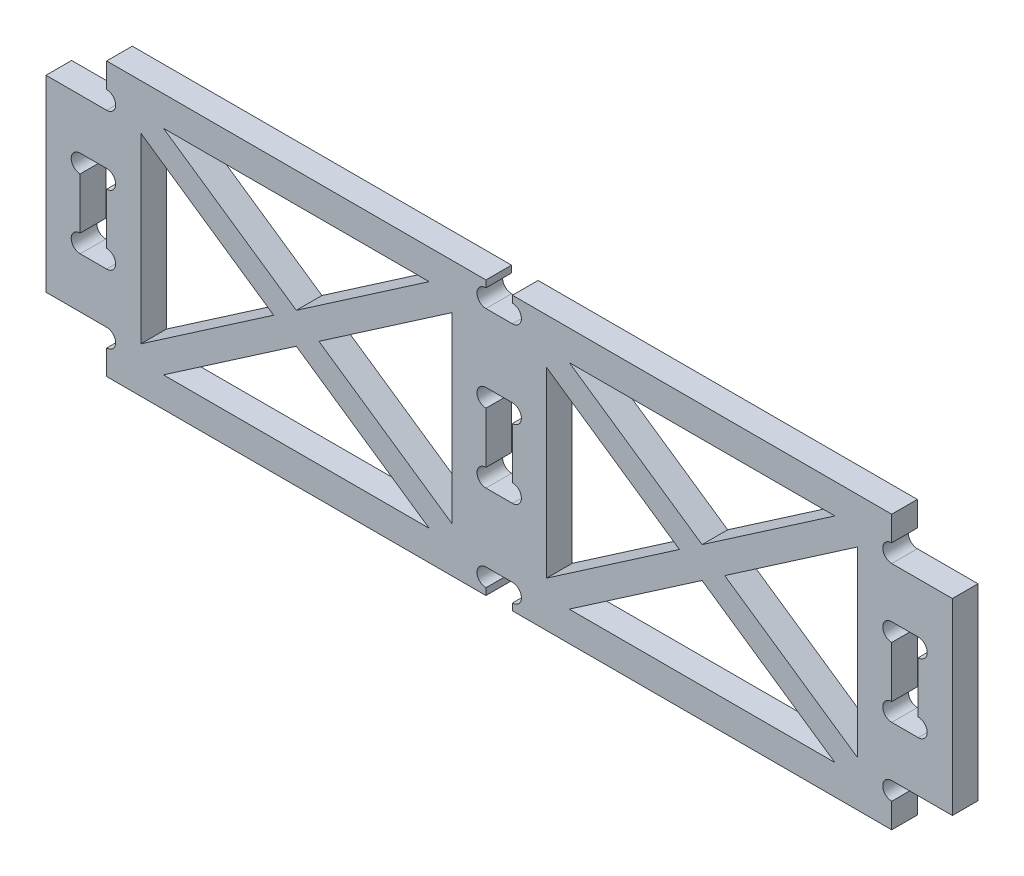
from build123d import *

# Parameters (mm, degrees)
EXTRUDE_1_DEPTH = 3


with BuildPart() as part:
    # 草图1 → 凸台-拉伸1 (new body)
    with BuildSketch(Plane.XY):
        with BuildLine():
            Line((100.55, -11), (100.55, 11))
            Line((100.55, 11), (93.45, 11))
            ThreePointArc((93.45, 11), (92.4, 12.05), (93.45, 13.1))
            Line((93.45, 13.1), (93.45, 16))
            Line((93.45, 16), (49.05, 16))
            Line((49.05, 16), (49.05, 15.2))
            ThreePointArc((49.05, 15.2), (49.79246212, 14.89246212), (50.1, 14.15))
            ThreePointArc((50.1, 14.15), (49.79246212, 13.40753788), (49.05, 13.1))
            Line((49.05, 13.1), (45.95, 13.1))
            ThreePointArc((45.95, 13.1), (44.9, 14.15), (45.95, 15.2))
            Line((45.95, 15.2), (45.95, 16))
            Line((45.95, 16), (1.55, 16))
            Line((1.55, 16), (1.55, 13.1))
            ThreePointArc((1.55, 13.1), (2.29246212, 12.79246212), (2.6, 12.05))
            ThreePointArc((2.6, 12.05), (2.29246212, 11.30753788), (1.55, 11))
            Line((1.55, 11), (-5.55, 11))
            Line((-5.55, 11), (-5.55, -11))
            Line((-5.55, -11), (1.55, -11))
            ThreePointArc((1.55, -11), (2.29246212, -11.30753788), (2.6, -12.05))
            ThreePointArc((2.6, -12.05), (2.29246212, -12.79246212), (1.55, -13.1))
            Line((1.55, -13.1), (1.55, -16))
            Line((1.55, -16), (45.95, -16))
            Line((45.95, -16), (45.95, -15.2))
            ThreePointArc((45.95, -15.2), (44.9, -14.15), (45.95, -13.1))
            Line((45.95, -13.1), (49.05, -13.1))
            ThreePointArc((49.05, -13.1), (49.79246212, -13.40753788), (50.1, -14.15))
            ThreePointArc((50.1, -14.15), (49.79246212, -14.89246212), (49.05, -15.2))
            Line((49.05, -15.2), (49.05, -16))
            Line((49.05, -16), (93.45, -16))
            Line((93.45, -16), (93.45, -13.1))
            ThreePointArc((93.45, -13.1), (92.4, -12.05), (93.45, -11))
            Line((93.45, -11), (100.55, -11))
        make_face()
        with BuildLine():
            ThreePointArc((2.6, -4.05), (2.29246212, -4.79246212), (1.55, -5.1))
            Line((1.55, -5.1), (-1.55, -5.1))
            ThreePointArc((-1.55, -5.1), (-2.6, -4.05), (-1.55, -3))
            Line((-1.55, -3), (-1.55, 3))
            ThreePointArc((-1.55, 3), (-2.6, 4.05), (-1.55, 5.1))
            Line((-1.55, 5.1), (1.55, 5.1))
            ThreePointArc((1.55, 5.1), (2.29246212, 4.79246212), (2.6, 4.05))
            ThreePointArc((2.6, 4.05), (2.29246212, 3.30753788), (1.55, 3))
            Line((1.55, 3), (1.55, -3))
            ThreePointArc((1.55, -3), (2.29246212, -3.30753788), (2.6, -4.05))
        make_face(mode=Mode.SUBTRACT)
        Polygon((39.300498915, -12.5), (8.199501085, -12.5), (23.75, -1.819712284), align=None, mode=Mode.SUBTRACT)
        Polygon((55.699501085, -12.5), (71.25, -1.819712284), (86.800498915, -12.5), align=None, mode=Mode.SUBTRACT)
        with BuildLine():
            ThreePointArc((97.6, -4.05), (97.29246212, -4.79246212), (96.55, -5.1))
            Line((96.55, -5.1), (93.45, -5.1))
            ThreePointArc((93.45, -5.1), (92.4, -4.05), (93.45, -3))
            Line((93.45, -3), (93.45, 3))
            ThreePointArc((93.45, 3), (92.4, 4.05), (93.45, 5.1))
            Line((93.45, 5.1), (96.55, 5.1))
            ThreePointArc((96.55, 5.1), (97.29246212, 4.79246212), (97.6, 4.05))
            ThreePointArc((97.6, 4.05), (97.29246212, 3.30753788), (96.55, 3))
            Line((96.55, 3), (96.55, -3))
            ThreePointArc((96.55, -3), (97.29246212, -3.30753788), (97.6, -4.05))
        make_face(mode=Mode.SUBTRACT)
        Polygon((21.100498915, 0), (5.55, -10.680287716), (5.55, 10.680287716), align=None, mode=Mode.SUBTRACT)
        Polygon((26.399501085, 0), (41.95, 10.680287716), (41.95, -10.680287716), align=None, mode=Mode.SUBTRACT)
        Polygon((23.75, 1.819712284), (8.199501085, 12.5), (39.300498915, 12.5), align=None, mode=Mode.SUBTRACT)
        with BuildLine():
            ThreePointArc((50.1, -4.05), (49.79246212, -4.79246212), (49.05, -5.1))
            Line((49.05, -5.1), (45.95, -5.1))
            ThreePointArc((45.95, -5.1), (44.9, -4.05), (45.95, -3))
            Line((45.95, -3), (45.95, 3))
            ThreePointArc((45.95, 3), (44.9, 4.05), (45.95, 5.1))
            Line((45.95, 5.1), (49.05, 5.1))
            ThreePointArc((49.05, 5.1), (49.79246212, 4.79246212), (50.1, 4.05))
            ThreePointArc((50.1, 4.05), (49.79246212, 3.30753788), (49.05, 3))
            Line((49.05, 3), (49.05, -3))
            ThreePointArc((49.05, -3), (49.79246212, -3.30753788), (50.1, -4.05))
        make_face(mode=Mode.SUBTRACT)
        Polygon((53.05, 10.680287716), (68.600498915, 0), (53.05, -10.680287716), align=None, mode=Mode.SUBTRACT)
        Polygon((55.699501085, 12.5), (86.800498915, 12.5), (71.25, 1.819712284), align=None, mode=Mode.SUBTRACT)
        Polygon((89.45, 10.680287716), (89.45, -10.680287716), (73.899501085, 0), align=None, mode=Mode.SUBTRACT)
    extrude(amount=EXTRUDE_1_DEPTH)


solid = part.part
